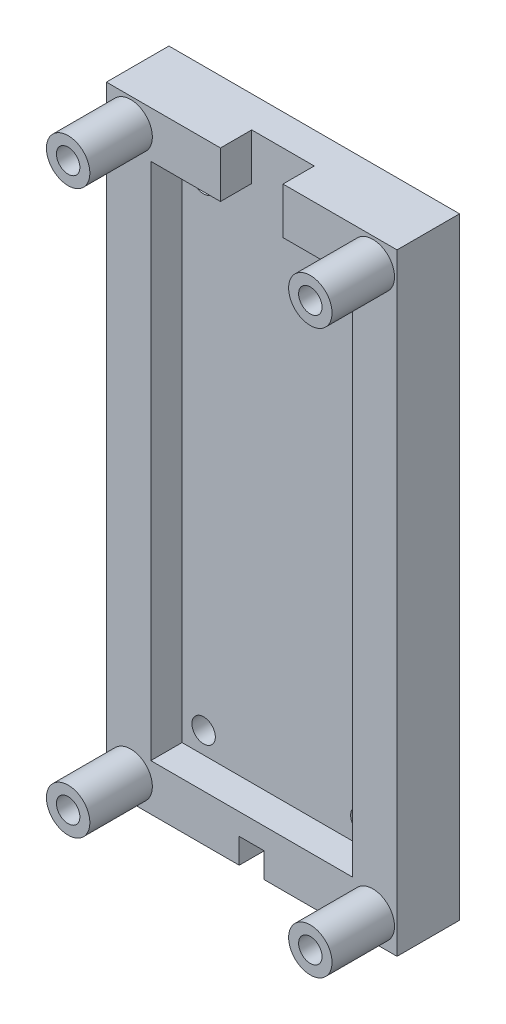
from build123d import *

# Parameters (mm, degrees)
SKETCH2_W                   = 46.5
SKETCH2_H                   = 97.9
SKETCH2_W_2                 = 32.3
SKETCH2_H_2                 = 83.05
BOSS_EXTRUDE1_DEPTH         = 5
SKETCH2_4_W                 = 32.3
SKETCH2_4_H                 = 83.05
SKETCH2_4_W_2               = 25.4
SKETCH2_4_H_2               = 76.2
BOSS_EXTRUDE2_DEPTH         = 5
TAP_DRILL_FOR_M3X0_5_TAP1_D = 3.75
SKETCH7_R                   = 3.475
SKETCH7_R_2                 = 1.875
BOSS_EXTRUDE5_DEPTH         = 15
BOSS_EXTRUDE4_DEPTH         = 97.55
CUT_EXTRUDE1_DEPTH          = 112.426738894
CUT_EXTRUDE1_DEPTH_BACK     = 112.426738894
CUT_EXTRUDE2_DEPTH          = 100.18712429
CUT_EXTRUDE2_DEPTH_BACK     = 5
SKETCH11_W                  = 10
SKETCH11_H                  = 15
SKETCH12_W                  = 4
SKETCH12_H                  = 8
CUT_EXTRUDE3_DEPTH          = 100.18712429


with BuildPart() as part:
    # Sketch2 → Boss-Extrude1 (new, symmetric)
    with BuildSketch(Plane.XY):
        with Locations((16.15, 41.525)):
            Rectangle(SKETCH2_W, SKETCH2_H)
        with Locations((16.15, 41.525)):
            Rectangle(SKETCH2_W_2, SKETCH2_H_2, mode=Mode.SUBTRACT)
    extrude(amount=BOSS_EXTRUDE1_DEPTH, both=True)

    # Sketch2<4> → Boss-Extrude2 (add)
    # profile 1 of 2: a face of its own
    with BuildSketch(Plane.XY):
        with Locations((16.15, 41.525)):
            Rectangle(SKETCH2_4_W, SKETCH2_4_H)
        with Locations((16.15, 41.525)):
            Rectangle(SKETCH2_4_W_2, SKETCH2_4_H_2, mode=Mode.SUBTRACT)
    # profile 2 of 2: a face of its own
    with BuildSketch(Plane.XY):
        with Locations((16.15, 41.525)):
            Rectangle(SKETCH2_4_W_2, SKETCH2_4_H_2)
    extrude(amount=-BOSS_EXTRUDE2_DEPTH)

    # Tap Drill for M3x0.5 Tap1 (through all)
    with Locations(Plane.XY):
        with Locations((3.45, 79.625), (28.85, 79.625), (3.45, 3.425), (28.85, 3.425)):
            Hole(TAP_DRILL_FOR_M3X0_5_TAP1_D / 2)

    # Sketch7 → Boss-Extrude5 (add)
    # profile 1 of 4: a face of its own
    with BuildSketch(Plane.XY):
        with Locations((-3.225, 86.525)):
            Circle(SKETCH7_R)
        with Locations((-3.225, 86.525)):
            Circle(SKETCH7_R_2, mode=Mode.SUBTRACT)
    # profile 2 of 4: a face of its own
    with BuildSketch(Plane.XY):
        with Locations((35.525, 86.525)):
            Circle(SKETCH7_R)
        with Locations((35.525, 86.525)):
            Circle(SKETCH7_R_2, mode=Mode.SUBTRACT)
    # profile 3 of 4: a face of its own
    with BuildSketch(Plane.XY):
        with Locations((-3.225, -3.475)):
            Circle(SKETCH7_R)
        with Locations((-3.225, -3.475)):
            Circle(SKETCH7_R_2, mode=Mode.SUBTRACT)
    # profile 4 of 4: a face of its own
    with BuildSketch(Plane.XY):
        with Locations((35.525, -3.475)):
            Circle(SKETCH7_R)
        with Locations((35.525, -3.475)):
            Circle(SKETCH7_R_2, mode=Mode.SUBTRACT)
    extrude(amount=BOSS_EXTRUDE5_DEPTH)

    # Sketch11 → Cut-Extrude2 (cut, two sides: drawn at the far end of the back side and taken through both)
    with BuildSketch(Plane.XY.offset(5).offset(-CUT_EXTRUDE2_DEPTH_BACK)):
        with Locations((16.15, 83.05)):
            Rectangle(SKETCH11_W, SKETCH11_H)
    extrude(amount=CUT_EXTRUDE2_DEPTH + CUT_EXTRUDE2_DEPTH_BACK, mode=Mode.SUBTRACT)

    # Sketch12 → Cut-Extrude3 (cut, through all)
    with BuildSketch(Plane.XY.offset(5)):
        with Locations((16.15, -7.425)):
            Rectangle(SKETCH12_W, SKETCH12_H)
    extrude(amount=-CUT_EXTRUDE3_DEPTH, mode=Mode.SUBTRACT)


with BuildPart() as body_2:
    # Sketch6 → Boss-Extrude4 (new body)
    with BuildSketch(Plane(origin=(0, 90.475, 0), x_dir=(1, 0, 0), z_dir=(0, 1, 0))):
        with BuildLine():
            Line((-12.283937642, -5.441846212), (-12.33484351, -5.441846212))
            ThreePointArc((-12.33484351, -5.441846212), (16.097911959, -28.999953221), (44.615111123, -5.544136432))
            Line((44.615111123, -5.544136432), (44.564169902, -5.544136432))
            ThreePointArc((44.564169902, -5.544136432), (16.097908608, -28.949953134), (-12.283937642, -5.441846212))
        make_face()
    extrude(amount=-BOSS_EXTRUDE4_DEPTH)

    # Sketch6<2> → Cut-Extrude1 (cut, two sides: drawn at the far end of the back side and taken through both)
    with BuildSketch(Plane(origin=(0, 90.475, 0), x_dir=(1, 0, 0), z_dir=(0, 1, 0)).offset(-CUT_EXTRUDE1_DEPTH_BACK)):
        with BuildLine():
            Line((-12.283937642, -5.441846212), (-12.33484351, -5.441846212))
            ThreePointArc((-12.33484351, -5.441846212), (16.097911959, -28.999953221), (44.615111123, -5.544136432))
            Line((44.615111123, -5.544136432), (44.564169902, -5.544136432))
            ThreePointArc((44.564169902, -5.544136432), (16.097908608, -28.949953134), (-12.283937642, -5.441846212))
        make_face()
    extrude(amount=CUT_EXTRUDE1_DEPTH + CUT_EXTRUDE1_DEPTH_BACK, mode=Mode.SUBTRACT)


solid = part.part
